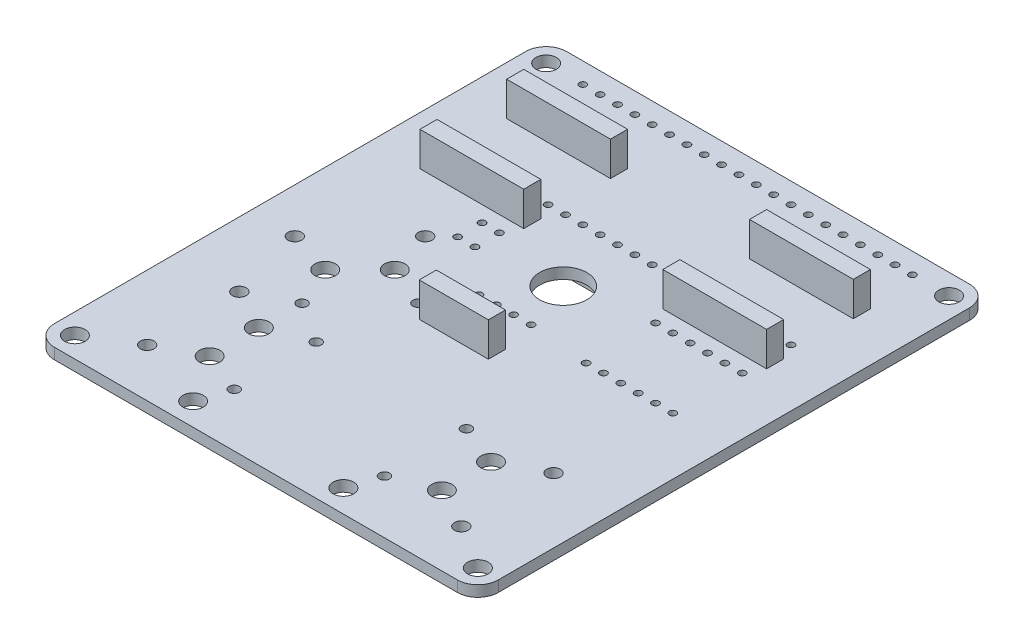
from build123d import *

# Parameters (mm, degrees)
MAIN_BODY_DEPTH            = 1.6002
POWER_SWITCH_DEPTH         = 66.633913795
POWER_SWITCH_DEPTH_BACK    = 66.633913795
POWER_SWITCH_SK_R          = 1.5
POWER_SWITCH_SK_R_2        = 3.4544
POWER_CONN_DEPTH           = 66.633913795
POWER_CONN_DEPTH_BACK      = 66.633913795
POWER_CONN_SK_R            = 1.5
POWER_CONN_SK_R_2          = 1
POWER_CONN_SK_R_3          = 0.75
LED_DEPTH                  = 66.633913795
LED_DEPTH_BACK             = 66.633913795
LED_SK_R                   = 0.5
RASPBERRYPI_DEPTH          = 66.633913795
RASPBERRYPI_DEPTH_BACK     = 66.633913795
RASPBERRYPI_SK_R           = 0.508
LED_MOUNT_DEPTH            = 66.633913795
LED_MOUNT_DEPTH_BACK       = 66.633913795
LED_MOUNT_SK_R             = 1.5
ACCEL_DEPTH                = 66.633913795
ACCEL_DEPTH_BACK           = 66.633913795
ACCEL_SK_R                 = 0.508
LOGICSHIFT_DEPTH           = 66.633913795
LOGICSHIFT_DEPTH_BACK      = 66.633913795
LOGICSHIFT_SK_R            = 0.508
ESC_DEPTH                  = 66.633913795
ESC_DEPTH_BACK             = 66.633913795
ESC_SK_R                   = 0.508
TOP_FEMALE_HEADERS_SK_W    = 50.76
TOP_FEMALE_HEADERS_SK_H    = 2.5
TOP_FEMALE_HEADERS_SK_W_2  = 10.12
TOP_FEMALE_HEADERS_SK_W_3  = 15.2
TOP_FEMALE_HEADERS_DEPTH   = 5
BOT_FEMALE_HEADERS_SK_W    = 15.2
BOT_FEMALE_HEADERS_SK_H    = 2.5
BOT_FEMALE_HEADERS_SK_W_2  = 10.12
BOT_FEMALE_HEADERS_DEPTH   = 5
TOP_MALE_HEADERS_SK_W      = 5.04
TOP_MALE_HEADERS_SK_H      = 2.5
TOP_MALE_HEADERS_DEPTH     = 2.5
TOP_MALE_HEADER_PINS_SK_R  = 0.5
TOP_MALE_HEADER_PINS_DEPTH = 5


with BuildPart() as part:
    # main_body_sk → main_body (new body)
    with BuildSketch(Plane(origin=(0, 0, 0), x_dir=(1, 0, 0), z_dir=(0, 1, 0))):
        with BuildLine():
            Line((-29.5, -57), (29.5, -57))
            ThreePointArc((29.5, -57), (31.621320344, -56.121320344), (32.5, -54))
            Line((32.5, -54), (32.5, 15))
            ThreePointArc((32.5, 15), (31.621320344, 17.121320344), (29.5, 18))
            Line((29.5, 18), (-29.5, 18))
            ThreePointArc((-29.5, 18), (-31.621320344, 17.121320344), (-32.5, 15))
            Line((-32.5, 15), (-32.5, -54))
            ThreePointArc((-32.5, -54), (-31.621320344, -56.121320344), (-29.5, -57))
        make_face()
    extrude(amount=MAIN_BODY_DEPTH)

    # power_switch_sk → power_switch (cut, two sides: drawn at the far end of the back side and taken through both)
    with BuildSketch(Plane(origin=(0, 1.6002, 0), x_dir=(1, 0, 0), z_dir=(0, 1, 0)).offset(-POWER_SWITCH_DEPTH_BACK)):
        with Locations((-29.5, 15)):
            Circle(POWER_SWITCH_SK_R)
        with Locations((29.5, 15)):
            Circle(POWER_SWITCH_SK_R)
        with Locations((29.5, -54)):
            Circle(POWER_SWITCH_SK_R)
        with Locations((-29.5, -54)):
            Circle(POWER_SWITCH_SK_R)
        with Locations((0, -12)):
            Circle(POWER_SWITCH_SK_R_2)
    extrude(amount=POWER_SWITCH_DEPTH + POWER_SWITCH_DEPTH_BACK, mode=Mode.SUBTRACT)

    # power_conn_sk → power_conn (cut, two sides: drawn at the far end of the back side and taken through both)
    with BuildSketch(Plane(origin=(0, 1.6002, 0), x_dir=(1, 0, 0), z_dir=(0, 1, 0)).offset(-POWER_CONN_DEPTH_BACK)):
        with Locations((-17, -46.775)):
            Circle(POWER_CONN_SK_R)
        with Locations((-17, -39.575)):
            Circle(POWER_CONN_SK_R)
        with Locations((17, -39.575)):
            Circle(POWER_CONN_SK_R)
        with Locations((17, -46.775)):
            Circle(POWER_CONN_SK_R)
        with Locations((-23, -36.425)):
            Circle(POWER_CONN_SK_R_2)
        with Locations((-23, -49.925)):
            Circle(POWER_CONN_SK_R_2)
        with Locations((23, -36.425)):
            Circle(POWER_CONN_SK_R_2)
        with Locations((23, -49.925)):
            Circle(POWER_CONN_SK_R_2)
        with Locations((-25.970027048, -25.334745674)):
            Circle(POWER_CONN_SK_R_2)
        with Locations((-16.424085502, -15.788804128)):
            Circle(POWER_CONN_SK_R_2)
        with Locations((-14.408831175, -22.258831175)):
            Circle(POWER_CONN_SK_R)
        with Locations((-19.5, -27.35)):
            Circle(POWER_CONN_SK_R)
        with Locations((-11, -37.175)):
            Circle(POWER_CONN_SK_R_3)
        with Locations((-11, -49.175)):
            Circle(POWER_CONN_SK_R_3)
        with Locations((11, -37.175)):
            Circle(POWER_CONN_SK_R_3)
        with Locations((11, -49.175)):
            Circle(POWER_CONN_SK_R_3)
        with Locations((-16.954415588, -33.289696962)):
            Circle(POWER_CONN_SK_R_3)
        with Locations((-8.469134213, -24.804415588)):
            Circle(POWER_CONN_SK_R_3)
    extrude(amount=POWER_CONN_DEPTH + POWER_CONN_DEPTH_BACK, mode=Mode.SUBTRACT)

    # led_sk → led (cut, two sides: drawn at the far end of the back side and taken through both)
    with BuildSketch(Plane(origin=(0, 1.6002, 0), x_dir=(1, 0, 0), z_dir=(0, 1, 0)).offset(-LED_DEPTH_BACK)):
        with Locations((-5.08, -25.5)):
            Circle(LED_SK_R)
        with Locations((-2.54, -25.5)):
            Circle(LED_SK_R)
        with Locations((0, -25.5)):
            Circle(LED_SK_R)
        with Locations((2.54, -25.5)):
            Circle(LED_SK_R)
        with Locations((-5.08, -19.25)):
            Circle(LED_SK_R)
        with Locations((-2.54, -19.25)):
            Circle(LED_SK_R)
        with Locations((0, -19.25)):
            Circle(LED_SK_R)
        with Locations((2.54, -19.25)):
            Circle(LED_SK_R)
    extrude(amount=LED_DEPTH + LED_DEPTH_BACK, mode=Mode.SUBTRACT)

    # raspberrypi_sk → raspberrypi (cut, two sides: drawn at the far end of the back side and taken through both)
    with BuildSketch(Plane(origin=(0, 1.6002, 0), x_dir=(1, 0, 0), z_dir=(0, 1, 0)).offset(-RASPBERRYPI_DEPTH_BACK)):
        with Locations((-24.13, 15)):
            Circle(RASPBERRYPI_SK_R)
        with Locations((-24.13, -2.78)):
            Circle(RASPBERRYPI_SK_R)
        with Locations((-21.59, 15)):
            Circle(RASPBERRYPI_SK_R)
        with Locations((-19.05, 15)):
            Circle(RASPBERRYPI_SK_R)
        with Locations((-16.51, 15)):
            Circle(RASPBERRYPI_SK_R)
        with Locations((-13.97, 15)):
            Circle(RASPBERRYPI_SK_R)
        with Locations((-11.43, 15)):
            Circle(RASPBERRYPI_SK_R)
        with Locations((-8.89, 15)):
            Circle(RASPBERRYPI_SK_R)
        with Locations((-6.35, 15)):
            Circle(RASPBERRYPI_SK_R)
        with Locations((-3.81, 15)):
            Circle(RASPBERRYPI_SK_R)
        with Locations((-1.27, 15)):
            Circle(RASPBERRYPI_SK_R)
        with Locations((-21.59, -2.78)):
            Circle(RASPBERRYPI_SK_R)
        with Locations((-19.05, -2.78)):
            Circle(RASPBERRYPI_SK_R)
        with Locations((-16.51, -2.78)):
            Circle(RASPBERRYPI_SK_R)
        with Locations((-13.97, -2.78)):
            Circle(RASPBERRYPI_SK_R)
        with Locations((-11.43, -2.78)):
            Circle(RASPBERRYPI_SK_R)
        with Locations((-8.89, -2.78)):
            Circle(RASPBERRYPI_SK_R)
        with Locations((-6.35, -2.78)):
            Circle(RASPBERRYPI_SK_R)
        with Locations((-3.81, -2.78)):
            Circle(RASPBERRYPI_SK_R)
        with Locations((-1.27, -2.78)):
            Circle(RASPBERRYPI_SK_R)
        with Locations((1.27, -2.78)):
            Circle(RASPBERRYPI_SK_R)
        with Locations((1.27, 15)):
            Circle(RASPBERRYPI_SK_R)
        with Locations((3.81, 15)):
            Circle(RASPBERRYPI_SK_R)
        with Locations((6.35, 15)):
            Circle(RASPBERRYPI_SK_R)
        with Locations((8.89, 15)):
            Circle(RASPBERRYPI_SK_R)
        with Locations((11.43, 15)):
            Circle(RASPBERRYPI_SK_R)
        with Locations((13.97, 15)):
            Circle(RASPBERRYPI_SK_R)
        with Locations((16.51, 15)):
            Circle(RASPBERRYPI_SK_R)
        with Locations((19.05, 15)):
            Circle(RASPBERRYPI_SK_R)
        with Locations((21.59, 15)):
            Circle(RASPBERRYPI_SK_R)
        with Locations((24.13, 15)):
            Circle(RASPBERRYPI_SK_R)
        with Locations((3.81, -2.78)):
            Circle(RASPBERRYPI_SK_R)
        with Locations((6.35, -2.78)):
            Circle(RASPBERRYPI_SK_R)
        with Locations((8.89, -2.78)):
            Circle(RASPBERRYPI_SK_R)
        with Locations((11.43, -2.78)):
            Circle(RASPBERRYPI_SK_R)
        with Locations((13.97, -2.78)):
            Circle(RASPBERRYPI_SK_R)
        with Locations((16.51, -2.78)):
            Circle(RASPBERRYPI_SK_R)
        with Locations((19.05, -2.78)):
            Circle(RASPBERRYPI_SK_R)
        with Locations((21.59, -2.78)):
            Circle(RASPBERRYPI_SK_R)
        with Locations((24.13, -2.78)):
            Circle(RASPBERRYPI_SK_R)
    extrude(amount=RASPBERRYPI_DEPTH + RASPBERRYPI_DEPTH_BACK, mode=Mode.SUBTRACT)

    # led_mount_sk → led_mount (cut, two sides: drawn at the far end of the back side and taken through both)
    with BuildSketch(Plane(origin=(0, 1.6002, 0), x_dir=(1, 0, 0), z_dir=(0, 1, 0)).offset(-LED_MOUNT_DEPTH_BACK)):
        with Locations((-12.5, -53.693008778)):
            Circle(LED_MOUNT_SK_R)
        with Locations((9.5, -53.693008778)):
            Circle(LED_MOUNT_SK_R)
    extrude(amount=LED_MOUNT_DEPTH + LED_MOUNT_DEPTH_BACK, mode=Mode.SUBTRACT)

    # accel_sk → accel (cut, two sides: drawn at the far end of the back side and taken through both)
    with BuildSketch(Plane(origin=(0, 1.6002, 0), x_dir=(1, 0, 0), z_dir=(0, 1, 0)).offset(-ACCEL_DEPTH_BACK)):
        with Locations((-24.13, 6.35)):
            Circle(ACCEL_SK_R)
        with Locations((-21.59, 6.35)):
            Circle(ACCEL_SK_R)
        with Locations((-19.05, 6.35)):
            Circle(ACCEL_SK_R)
        with Locations((-16.51, 6.35)):
            Circle(ACCEL_SK_R)
        with Locations((-13.97, 6.35)):
            Circle(ACCEL_SK_R)
        with Locations((-11.43, 6.35)):
            Circle(ACCEL_SK_R)
        with Locations((-24.13, -6.35)):
            Circle(ACCEL_SK_R)
        with Locations((-21.59, -6.35)):
            Circle(ACCEL_SK_R)
        with Locations((-19.05, -6.35)):
            Circle(ACCEL_SK_R)
        with Locations((-16.51, -6.35)):
            Circle(ACCEL_SK_R)
        with Locations((-13.97, -6.35)):
            Circle(ACCEL_SK_R)
        with Locations((-11.43, -6.35)):
            Circle(ACCEL_SK_R)
        with Locations((11.43, 6.35)):
            Circle(ACCEL_SK_R)
        with Locations((13.97, 6.35)):
            Circle(ACCEL_SK_R)
        with Locations((16.51, 6.35)):
            Circle(ACCEL_SK_R)
        with Locations((19.05, 6.35)):
            Circle(ACCEL_SK_R)
        with Locations((21.59, 6.35)):
            Circle(ACCEL_SK_R)
        with Locations((24.13, 6.35)):
            Circle(ACCEL_SK_R)
        with Locations((11.43, -6.35)):
            Circle(ACCEL_SK_R)
        with Locations((13.97, -6.35)):
            Circle(ACCEL_SK_R)
        with Locations((16.51, -6.35)):
            Circle(ACCEL_SK_R)
        with Locations((19.05, -6.35)):
            Circle(ACCEL_SK_R)
        with Locations((21.59, -6.35)):
            Circle(ACCEL_SK_R)
        with Locations((24.13, -6.35)):
            Circle(ACCEL_SK_R)
    extrude(amount=ACCEL_DEPTH + ACCEL_DEPTH_BACK, mode=Mode.SUBTRACT)

    # logicshift_sk → logicshift (cut, two sides: drawn at the far end of the back side and taken through both)
    with BuildSketch(Plane(origin=(0, 1.6002, 0), x_dir=(1, 0, 0), z_dir=(0, 1, 0)).offset(-LOGICSHIFT_DEPTH_BACK)):
        with Locations((11.43, -9.92)):
            Circle(LOGICSHIFT_SK_R)
        with Locations((13.97, -9.92)):
            Circle(LOGICSHIFT_SK_R)
        with Locations((16.51, -9.92)):
            Circle(LOGICSHIFT_SK_R)
        with Locations((19.05, -9.92)):
            Circle(LOGICSHIFT_SK_R)
        with Locations((21.59, -9.92)):
            Circle(LOGICSHIFT_SK_R)
        with Locations((24.13, -9.92)):
            Circle(LOGICSHIFT_SK_R)
        with Locations((11.43, -20.08)):
            Circle(LOGICSHIFT_SK_R)
        with Locations((13.97, -20.08)):
            Circle(LOGICSHIFT_SK_R)
        with Locations((16.51, -20.08)):
            Circle(LOGICSHIFT_SK_R)
        with Locations((19.05, -20.08)):
            Circle(LOGICSHIFT_SK_R)
        with Locations((21.59, -20.08)):
            Circle(LOGICSHIFT_SK_R)
        with Locations((24.13, -20.08)):
            Circle(LOGICSHIFT_SK_R)
    extrude(amount=LOGICSHIFT_DEPTH + LOGICSHIFT_DEPTH_BACK, mode=Mode.SUBTRACT)

    # esc_sk → esc (cut, two sides: drawn at the far end of the back side and taken through both)
    with BuildSketch(Plane.XZ.offset(-ESC_DEPTH_BACK)):
        with Locations((-13.97, 9.92)):
            Circle(ESC_SK_R)
        with Locations((-11.43, 13.49)):
            Circle(ESC_SK_R)
        with Locations((-13.97, 13.49)):
            Circle(ESC_SK_R)
        with Locations((-11.43, 9.92)):
            Circle(ESC_SK_R)
    extrude(amount=ESC_DEPTH + ESC_DEPTH_BACK, mode=Mode.SUBTRACT)

    # top_female_headers_sk → top_female_headers (add)
    with BuildSketch(Plane.XZ):
        with Locations((0, 2.78)):
            Rectangle(TOP_FEMALE_HEADERS_SK_W, TOP_FEMALE_HEADERS_SK_H)
        with Locations((0, -15)):
            Rectangle(TOP_FEMALE_HEADERS_SK_W, TOP_FEMALE_HEADERS_SK_H)
        with Locations((-1.27, 19.25)):
            Rectangle(TOP_FEMALE_HEADERS_SK_W_2, TOP_FEMALE_HEADERS_SK_H)
        with Locations((17.78, 9.92)):
            Rectangle(TOP_FEMALE_HEADERS_SK_W_3, TOP_FEMALE_HEADERS_SK_H)
        with Locations((17.78, 20.08)):
            Rectangle(TOP_FEMALE_HEADERS_SK_W_3, TOP_FEMALE_HEADERS_SK_H)
    extrude(amount=TOP_FEMALE_HEADERS_DEPTH)

    # bot_female_headers_sk → bot_female_headers (add)
    with BuildSketch(Plane(origin=(0, 1.6002, 0), x_dir=(1, 0, 0), z_dir=(0, 1, 0))):
        with Locations((-17.78, 6.35)):
            Rectangle(BOT_FEMALE_HEADERS_SK_W, BOT_FEMALE_HEADERS_SK_H)
        with Locations((17.78, 6.35)):
            Rectangle(BOT_FEMALE_HEADERS_SK_W, BOT_FEMALE_HEADERS_SK_H)
        with Locations((-17.78, -6.35)):
            Rectangle(BOT_FEMALE_HEADERS_SK_W, BOT_FEMALE_HEADERS_SK_H)
        with Locations((17.78, -6.35)):
            Rectangle(BOT_FEMALE_HEADERS_SK_W, BOT_FEMALE_HEADERS_SK_H)
        with Locations((-1.27, -25.5)):
            Rectangle(BOT_FEMALE_HEADERS_SK_W_2, BOT_FEMALE_HEADERS_SK_H)
    extrude(amount=BOT_FEMALE_HEADERS_DEPTH)

    # top_male_headers_sk → top_male_headers (add)
    with BuildSketch(Plane.XZ):
        with Locations((-12.7, 13.49)):
            Rectangle(TOP_MALE_HEADERS_SK_W, TOP_MALE_HEADERS_SK_H)
        with Locations((-12.7, 9.92)):
            Rectangle(TOP_MALE_HEADERS_SK_W, TOP_MALE_HEADERS_SK_H)
    extrude(amount=TOP_MALE_HEADERS_DEPTH)

    # top_male_header_pins_sk → top_male_header_pins (add)
    with BuildSketch(Plane.XZ.offset(2.5)):
        with Locations((-13.97, 13.49)):
            Circle(TOP_MALE_HEADER_PINS_SK_R)
        with Locations((-11.43, 13.49)):
            Circle(TOP_MALE_HEADER_PINS_SK_R)
        with Locations((-11.43, 9.92)):
            Circle(TOP_MALE_HEADER_PINS_SK_R)
        with Locations((-13.97, 9.92)):
            Circle(TOP_MALE_HEADER_PINS_SK_R)
    extrude(amount=TOP_MALE_HEADER_PINS_DEPTH)


solid = part.part
